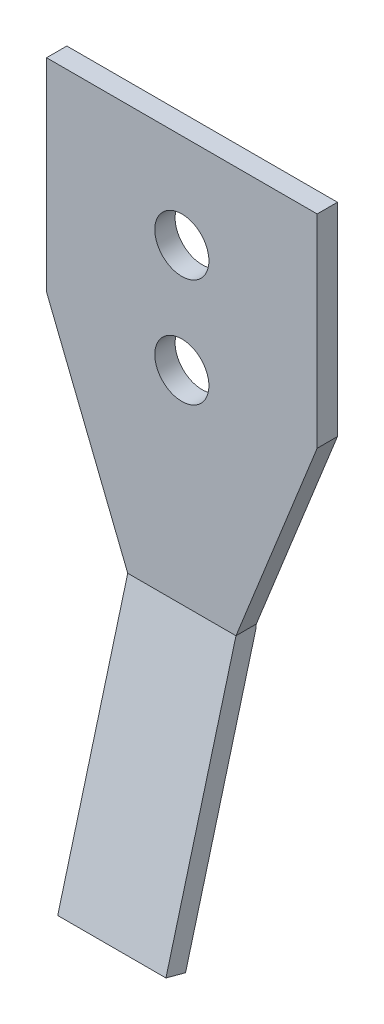
from build123d import *

# Parameters (mm, degrees)
SKETCH1_W           = 200
SKETCH1_H           = 300
SKETCH1_R           = 20
BOSS_EXTRUDE1_DEPTH = 15
CUT_EXTRUDE1_DEPTH  = 15
SKETCH3_W           = 80
SKETCH3_H           = 15
REVOLVE1_ANGLE      = 15
SKETCH4_W           = 80
SKETCH4_H           = 15
BOSS_EXTRUDE3_DEPTH = 200


with BuildPart() as part:
    # Sketch1 → Boss-Extrude1 (new body)
    with BuildSketch(Plane.XY):
        with Locations((-100, 150)):
            Rectangle(SKETCH1_W, SKETCH1_H)
        with Locations((-100, 230)):
            Circle(SKETCH1_R, mode=Mode.SUBTRACT)
        with Locations((-100, 150)):
            Circle(SKETCH1_R, mode=Mode.SUBTRACT)
    extrude(amount=BOSS_EXTRUDE1_DEPTH)

    # Sketch2 → Cut-Extrude1 (cut)
    with BuildSketch(Plane(origin=(0, 0, 0), x_dir=(-1, 0, 0), z_dir=(0, 0, -1))):
        Polygon((0, 0), (60, 0), (0, 150), align=None)
        Polygon((200, 0), (140, 0), (200, 150), align=None)
    extrude(amount=-CUT_EXTRUDE1_DEPTH, mode=Mode.SUBTRACT)

    # Sketch3 → Revolve1 (revolve)
    with BuildSketch(Plane.XZ):
        with Locations((-100, 7.5)):
            Rectangle(SKETCH3_W, SKETCH3_H)
    revolve(axis=Axis((-60, 0, 15), (-1, 0, 0)), revolution_arc=REVOLVE1_ANGLE)

    # Sketch4 → Boss-Extrude3 (add)
    with BuildSketch(Plane(origin=(0, -3.75, 1.004809472), x_dir=(1, 0, 0), z_dir=(0, -0.9659258262890681, 0.25881904510252135))):
        with Locations((-100, 6.988887394)):
            Rectangle(SKETCH4_W, SKETCH4_H)
    extrude(amount=BOSS_EXTRUDE3_DEPTH)


solid = part.part
